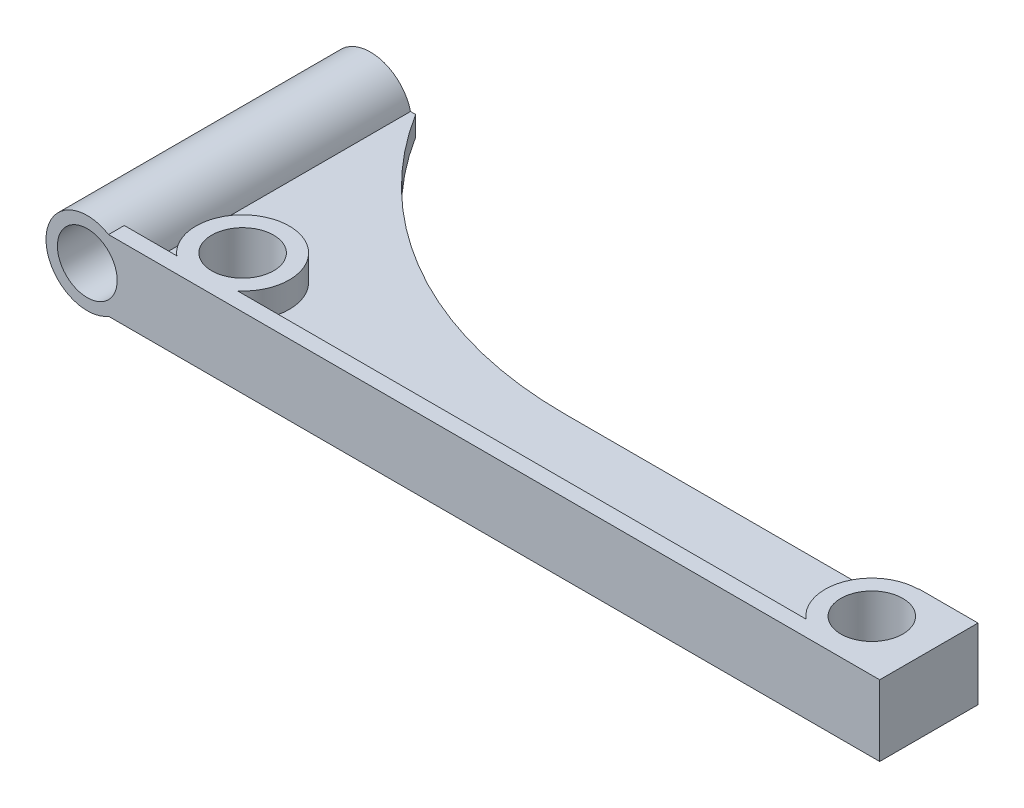
from build123d import *

# Parameters (mm, degrees)
SKETCH1_R           = 10.5
BOSS_EXTRUDE1_DEPTH = 72
SKETCH2_R           = 7.6
CUT_EXTRUDE5_DEPTH  = 74.515304529
BOSS_EXTRUDE2_DEPTH = 72
CUT_EXTRUDE2_START  = -68
CUT_EXTRUDE2_DEPTH  = 68
CUT_EXTRUDE3_DEPTH  = 215.371756535
SKETCH6_R           = 7.875
CUT_EXTRUDE4_DEPTH  = 215.371756535
EXTRUDE_THIN1_START = 6.5
SKETCH7_R           = 11.875
SKETCH7_R_2         = 7.875
EXTRUDE_THIN1_DEPTH = 6.5
BOSS_EXTRUDE3_START = 6.5
BOSS_EXTRUDE3_DEPTH = 6.5


with BuildPart() as part:
    # Sketch1 → Boss-Extrude1 (new body)
    with BuildSketch(Plane.XY):
        Circle(SKETCH1_R)
    extrude(amount=-BOSS_EXTRUDE1_DEPTH)

    # Sketch2 → Cut-Extrude5 (cut, through all)
    with BuildSketch(Plane.XY):
        Circle(SKETCH2_R)
    extrude(amount=-CUT_EXTRUDE5_DEPTH, mode=Mode.SUBTRACT)

    # Sketch3 → Boss-Extrude2 (add)
    with BuildSketch(Plane.XY):
        with BuildLine():
            Line((5.408326913, 9), (201.5, 9))
            Line((201.5, 9), (201.5, -9))
            Line((201.5, -9), (5.408326913, -9))
            ThreePointArc((5.408326913, -9), (10.5, 0), (5.408326913, 9))
        make_face()
    extrude(amount=-BOSS_EXTRUDE2_DEPTH)

    # Sketch4 → Cut-Extrude2 (cut)
    with BuildSketch(Plane(origin=(0, 0, -72), x_dir=(-1, 0, 0), z_dir=(0, 0, -1)).offset(CUT_EXTRUDE2_START)):
        with BuildLine():
            Line((-201.5, 9), (-201.5, 2.5))
            Line((-201.5, 2.5), (-10.198039027, 2.5))
            ThreePointArc((-10.198039027, 2.5), (-8.452938215, 6.228790856), (-5.408326913, 9))
            Line((-5.408326913, 9), (-201.5, 9))
        make_face()
    cut_extrude2 = extrude(amount=CUT_EXTRUDE2_DEPTH, mode=Mode.SUBTRACT)

    # Mirror1: Cut-Extrude2 across plane
    add(cut_extrude2.mirror(Plane.ZX), mode=Mode.SUBTRACT)

    # Sketch5 → Cut-Extrude3 (cut, through all)
    with BuildSketch(Plane(origin=(0, 2.5, 0), x_dir=(1, 0, 0), z_dir=(0, 1, 0))):
        with BuildLine():
            Line((96.299764151, 25), (201.5, 25))
            Line((201.5, 25), (201.5, 72))
            Line((201.5, 72), (11.5, 72))
            ThreePointArc((11.5, 72), (47.822965576, 37.535721577), (96.299764151, 25))
        make_face()
    extrude(amount=-CUT_EXTRUDE3_DEPTH, mode=Mode.SUBTRACT)

    # Sketch6 → Cut-Extrude4 (cut, through all)
    with BuildSketch(Plane.XZ.offset(2.5)):
        with Locations(Location((186.5, -13, 0), (0, 0, 270))):
            Circle(SKETCH6_R)
        with Locations(Location((26.5, -13, 0), (0, 0, 270))):
            Circle(SKETCH6_R)
    extrude(amount=-CUT_EXTRUDE4_DEPTH, mode=Mode.SUBTRACT)

    # Sketch7 → Extrude-Thin1 (add)
    # profile 1 of 2: a face of its own
    with BuildSketch(Plane.XZ.offset(2.5).offset(EXTRUDE_THIN1_START)):
        with Locations((26.5, -13)):
            Circle(SKETCH7_R)
        with Locations((26.5, -13)):
            Circle(SKETCH7_R_2, mode=Mode.SUBTRACT)
    # profile 2 of 2: a face of its own
    with BuildSketch(Plane.XZ.offset(2.5).offset(EXTRUDE_THIN1_START)):
        with Locations((186.5, -13)):
            Circle(SKETCH7_R)
        with Locations((186.5, -13)):
            Circle(SKETCH7_R_2, mode=Mode.SUBTRACT)
    extrude_thin1 = extrude(amount=-EXTRUDE_THIN1_DEPTH)

    # Sketch8 → Boss-Extrude3 (add)
    with BuildSketch(Plane.XZ.offset(2.5).offset(BOSS_EXTRUDE3_START)):
        with BuildLine():
            Line((201.5, -4), (194.246975216, -4))
            ThreePointArc((194.246975216, -4), (197.633072914, -17.13162347), (186.5, -24.875))
            Line((186.5, -24.875), (186.5, -25))
            Line((186.5, -25), (201.5, -25))
            Line((201.5, -25), (201.5, -4))
        make_face()
    boss_extrude3 = extrude(amount=-BOSS_EXTRUDE3_DEPTH)

    # Mirror2: Extrude-Thin1, Boss-Extrude3 across plane
    add(extrude_thin1.mirror(Plane.ZX))
    add(boss_extrude3.mirror(Plane.ZX))


solid = part.part
